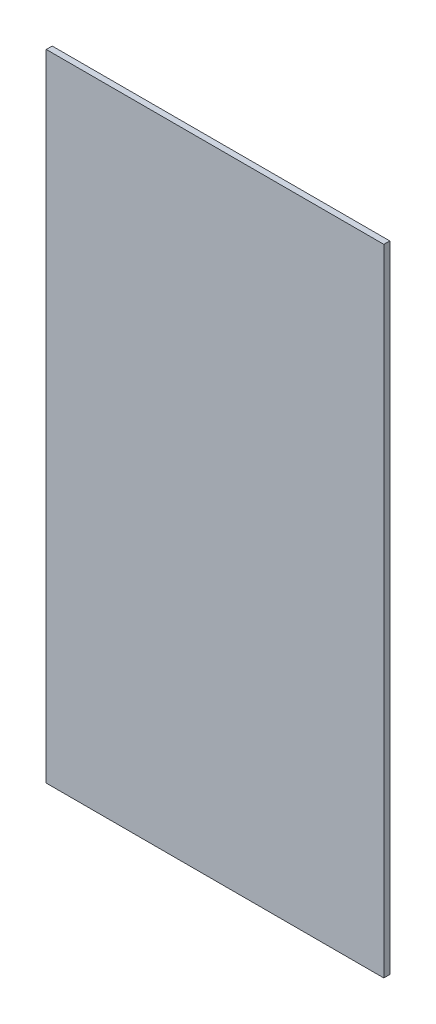
from build123d import *

# Parameters (mm, degrees)
CROQUIS2_W              = 170
CROQUIS2_H              = 320
SALIENTE_EXTRUIR1_DEPTH = 3


with BuildPart() as part:
    # Croquis2 → Saliente-Extruir1 (new body)
    with BuildSketch(Plane.XY):
        Rectangle(CROQUIS2_W, CROQUIS2_H)
    extrude(amount=SALIENTE_EXTRUIR1_DEPTH)


solid = part.part
